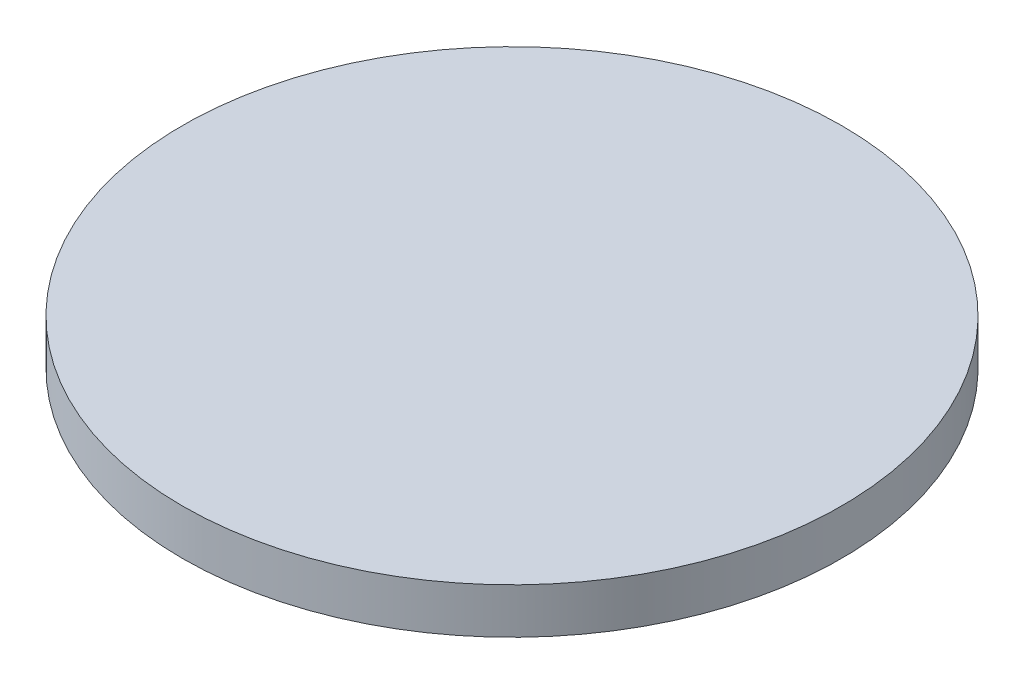
from build123d import *

# Parameters (mm, degrees)
PRESS_PZP400_UST_PLAKA_D290_START = 1000
SKETCH1_R                         = 145
PRESS_PZP400_UST_PLAKA_D290_DEPTH = 20


with BuildPart() as part:
    # Sketch1 → PRESS_PZP400_ust_plaka_D290 (new body)
    with BuildSketch(Plane(origin=(0, 0, 0), x_dir=(1, 0, 0), z_dir=(0, 1, 0)).offset(PRESS_PZP400_UST_PLAKA_D290_START)):
        with Locations(Location((350, 280, 0), (0, 0, 270))):
            Circle(SKETCH1_R)
    extrude(amount=PRESS_PZP400_UST_PLAKA_D290_DEPTH)


solid = part.part
